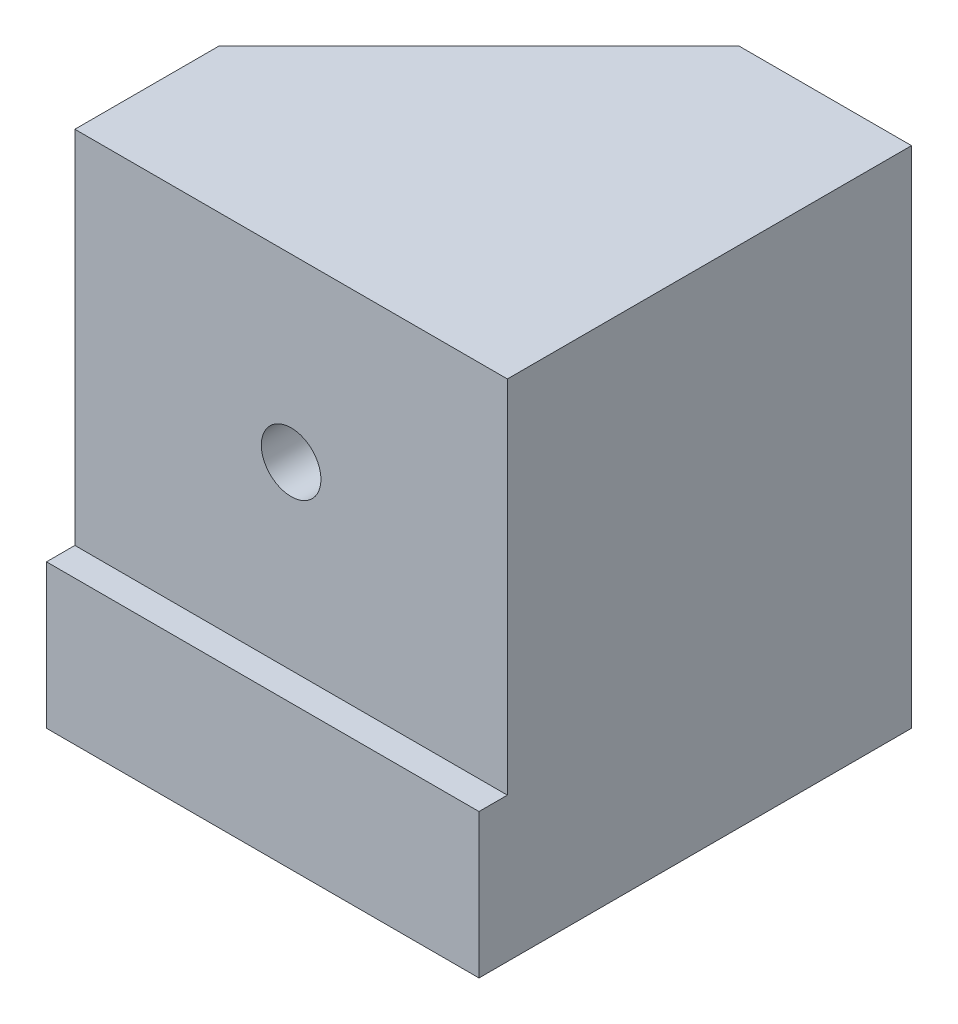
from build123d import *

# Parameters (mm, degrees)
SKETCH1_W           = 76.2
SKETCH1_H           = 76.2
BOSS_EXTRUDE1_DEPTH = 88.9
SKETCH2_R           = 5.25
CUT_EXTRUDE1_DEPTH  = 300
SKETCH3_W           = 76.2
SKETCH3_H           = 63.5
CUT_EXTRUDE2_DEPTH  = 5
CUT_EXTRUDE5_DEPTH  = 140.7


with BuildPart() as part:
    # Sketch1 → Boss-Extrude1 (new body)
    with BuildSketch(Plane(origin=(0, 0, 0), x_dir=(1, 0, 0), z_dir=(0, 1, 0))):
        with Locations((38.1, 38.1)):
            Rectangle(SKETCH1_W, SKETCH1_H)
    extrude(amount=BOSS_EXTRUDE1_DEPTH)

    # Sketch2 → Cut-Extrude1 (cut)
    with BuildSketch(Plane.XY):
        with Locations((38.1, 57.15)):
            Circle(SKETCH2_R)
    extrude(amount=-CUT_EXTRUDE1_DEPTH, mode=Mode.SUBTRACT)

    # Sketch3 → Cut-Extrude2 (cut)
    with BuildSketch(Plane.XY):
        with Locations((38.1, 57.15)):
            Rectangle(SKETCH3_W, SKETCH3_H)
    extrude(amount=-CUT_EXTRUDE2_DEPTH, mode=Mode.SUBTRACT)

    # Sketch5 → Cut-Extrude5 (cut, through all)
    with BuildSketch(Plane(origin=(0, 88.9, 0), x_dir=(1, 0, 0), z_dir=(0, 1, 0))):
        Polygon((0, 76.2), (0, 30.4), (45.8, 76.2), align=None)
    extrude(amount=-CUT_EXTRUDE5_DEPTH, mode=Mode.SUBTRACT)


solid = part.part
